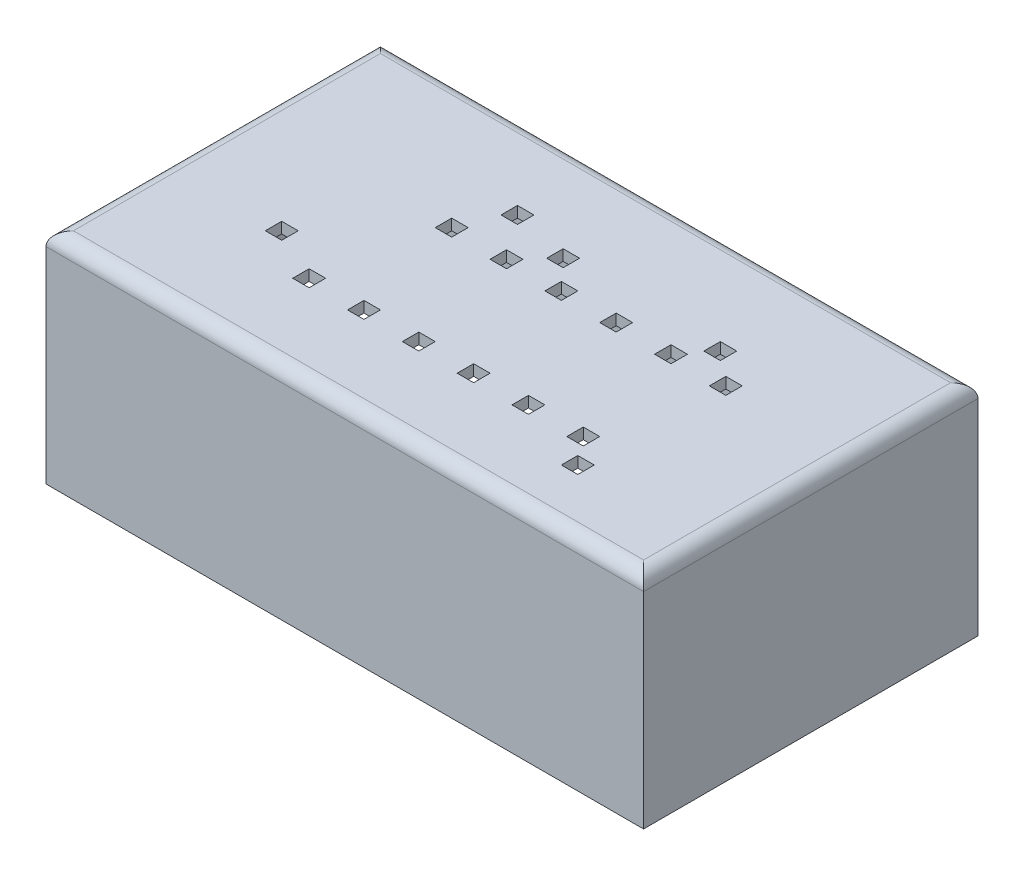
from build123d import *

# Parameters (mm, degrees)
SKETCH1_W           = 105
SKETCH1_H           = 57
BOSS_EXTRUDE1_DEPTH = 2
SKETCH2_W           = 109
SKETCH2_H           = 61
SKETCH2_W_2         = 105
SKETCH2_H_2         = 57
BOSS_EXTRUDE2_DEPTH = 40
SKETCH3_W           = 13
SKETCH3_H           = 14
SKETCH3_W_2         = 10
CUT_EXTRUDE1_DEPTH  = 2
SKETCH4_W           = 3
SKETCH4_H           = 3
CUT_EXTRUDE2_DEPTH  = 2
LPATTERN1_COUNT     = 6
LPATTERN1_PITCH     = 10
SKETCH5_W           = 3
SKETCH5_H           = 3
CUT_EXTRUDE3_DEPTH  = 2
LPATTERN2_COUNT     = 6
LPATTERN2_PITCH     = 10
SKETCH6_W           = 3
SKETCH6_H           = 3
CUT_EXTRUDE4_DEPTH  = 2
SKETCH7_W           = 3
SKETCH7_H           = 3
CUT_EXTRUDE5_DEPTH  = 2
FILLET2_R           = 2.5


with BuildPart() as part:
    # Sketch1 → Boss-Extrude1 (new body)
    with BuildSketch(Plane(origin=(0, 0, 0), x_dir=(1, 0, 0), z_dir=(0, 1, 0))):
        Rectangle(SKETCH1_W, SKETCH1_H)
    extrude(amount=-BOSS_EXTRUDE1_DEPTH)

    # Sketch2 → Boss-Extrude2 (add)
    with BuildSketch(Plane(origin=(0, 0, 0), x_dir=(1, 0, 0), z_dir=(0, 1, 0))):
        Rectangle(SKETCH2_W, SKETCH2_H)
        Rectangle(SKETCH2_W_2, SKETCH2_H_2, mode=Mode.SUBTRACT)
    extrude(amount=-BOSS_EXTRUDE2_DEPTH)

    # Sketch3 → Cut-Extrude1 (cut)
    with BuildSketch(Plane.ZY.offset(54.5)):
        with Locations((-15, -33)):
            Rectangle(SKETCH3_W, SKETCH3_H)
        with Locations((18.5, -33)):
            Rectangle(SKETCH3_W_2, SKETCH3_H)
    extrude(amount=-CUT_EXTRUDE1_DEPTH, mode=Mode.SUBTRACT)

    # Sketch4 → Cut-Extrude2 (cut)
    with BuildSketch(Plane(origin=(0, 0, 0), x_dir=(1, 0, 0), z_dir=(0, 1, 0))):
        with Locations((-23, -14)):
            Rectangle(SKETCH4_W, SKETCH4_H)
    cut_extrude2 = extrude(amount=-CUT_EXTRUDE2_DEPTH, mode=Mode.SUBTRACT)

    # LPattern1: Cut-Extrude2 ×6
    with Locations(*[(i * LPATTERN1_PITCH, 0, 0) for i in range(1, LPATTERN1_COUNT)]):
        add(cut_extrude2, mode=Mode.SUBTRACT)

    # Sketch5 → Cut-Extrude3 (cut)
    with BuildSketch(Plane(origin=(0, 0, 0), x_dir=(1, 0, 0), z_dir=(0, 1, 0))):
        with Locations((-18, 7)):
            Rectangle(SKETCH5_W, SKETCH5_H)
    cut_extrude3 = extrude(amount=-CUT_EXTRUDE3_DEPTH, mode=Mode.SUBTRACT)

    # LPattern2: Cut-Extrude3 ×6
    with Locations(*[(i * LPATTERN2_PITCH, 0, 0) for i in range(1, LPATTERN2_COUNT)]):
        add(cut_extrude3, mode=Mode.SUBTRACT)

    # Sketch6 → Cut-Extrude4 (cut)
    with BuildSketch(Plane(origin=(0, 0, 0), x_dir=(1, 0, 0), z_dir=(0, 1, 0))):
        with Locations((-14, 15)):
            Rectangle(SKETCH6_W, SKETCH6_H)
        with Locations((-3, 12.331798483)):
            Rectangle(SKETCH6_W, SKETCH6_H)
    extrude(amount=-CUT_EXTRUDE4_DEPTH, mode=Mode.SUBTRACT)

    # Sketch7 → Cut-Extrude5 (cut)
    with BuildSketch(Plane(origin=(0, 0, 0), x_dir=(1, 0, 0), z_dir=(0, 1, 0))):
        with Locations((-33, -9)):
            Rectangle(SKETCH7_W, SKETCH7_H)
        with Locations((26, 12)):
            Rectangle(SKETCH7_W, SKETCH7_H)
        with Locations((31, -19)):
            Rectangle(SKETCH7_W, SKETCH7_H)
    extrude(amount=-CUT_EXTRUDE5_DEPTH, mode=Mode.SUBTRACT)

    # Fillet2
    fillet2_edges = [part.edges().sort_by_distance(p)[0] for p in [
        (-54.5, 0, 0),
        (0, 0, 30.5),
        (54.5, 0, 0),
        (0, 0, -30.5),
    ]]
    fillet(fillet2_edges, radius=FILLET2_R)


solid = part.part
